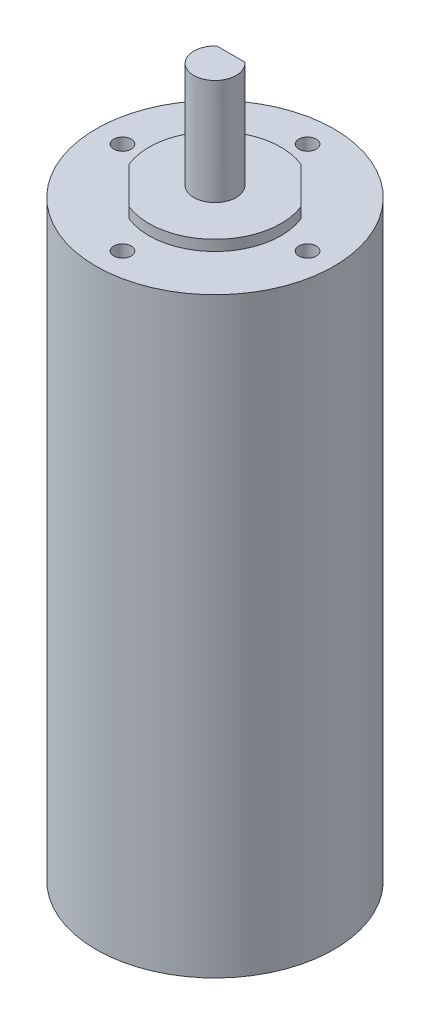
from build123d import *

# Parameters (mm, degrees)
SKETCH1_R           = 22.5
BOSS_EXTRUDE1_DEPTH = 111.9
BOSS_EXTRUDE2_DEPTH = 2
SKETCH3_R           = 4
BOSS_EXTRUDE3_DEPTH = 8
BOSS_EXTRUDE4_DEPTH = 12
SKETCH5_R           = 1.65
CUT_EXTRUDE1_DEPTH  = 6


with BuildPart() as part:
    # Sketch1 → Boss-Extrude1 (new body)
    with BuildSketch(Plane(origin=(0, 0, 0), x_dir=(1, 0, 0), z_dir=(0, 1, 0))):
        with Locations(Location((0, 0, 0), (0, 0, 90))):
            Circle(SKETCH1_R)
    extrude(amount=BOSS_EXTRUDE1_DEPTH)

    # Sketch2 → Boss-Extrude2 (add)
    with BuildSketch(Plane(origin=(0, 111.9, 0), x_dir=(1, 0, 0), z_dir=(0, 1, 0))):
        with BuildLine():
            Line((-11.59583, -4.667626), (-4.667626, -11.59583))
            ThreePointArc((-4.667626, -11.59583), (8.838835, -8.838835), (11.59583, 4.667626))
            Line((11.59583, 4.667626), (4.667626, 11.59583))
            ThreePointArc((4.667626, 11.59583), (-8.838835, 8.838835), (-11.59583, -4.667626))
        make_face()
    extrude(amount=BOSS_EXTRUDE2_DEPTH)

    # Sketch3 → Boss-Extrude3 (add)
    with BuildSketch(Plane(origin=(0, 113.9, 0), x_dir=(1, 0, 0), z_dir=(0, 1, 0))):
        with Locations(Location((0, 0, 0), (0, 0, 270))):
            Circle(SKETCH3_R)
    extrude(amount=BOSS_EXTRUDE3_DEPTH)

    # Sketch4 → Boss-Extrude4 (add)
    with BuildSketch(Plane(origin=(0, 121.9, 0), x_dir=(1, 0, 0), z_dir=(0, 1, 0))):
        with BuildLine():
            Line((-2.645751, 3), (2.645751, 3))
            ThreePointArc((2.645751, 3), (0, -4), (-2.645751, 3))
        make_face()
    extrude(amount=BOSS_EXTRUDE4_DEPTH)

    # Sketch5 → Cut-Extrude1 (cut)
    with BuildSketch(Plane(origin=(0, 111.9, 0), x_dir=(1, 0, 0), z_dir=(0, 1, 0))):
        with Locations(Location((-17.5, 0, 0), (0, 0, 270))):
            Circle(SKETCH5_R)
        with Locations(Location((0, 17.5, 0), (0, 0, 270))):
            Circle(SKETCH5_R)
        with Locations(Location((17.5, 0, 0), (0, 0, 270))):
            Circle(SKETCH5_R)
        with Locations(Location((0, -17.5, 0), (0, 0, 270))):
            Circle(SKETCH5_R)
    extrude(amount=-CUT_EXTRUDE1_DEPTH, mode=Mode.SUBTRACT)


solid = part.part
